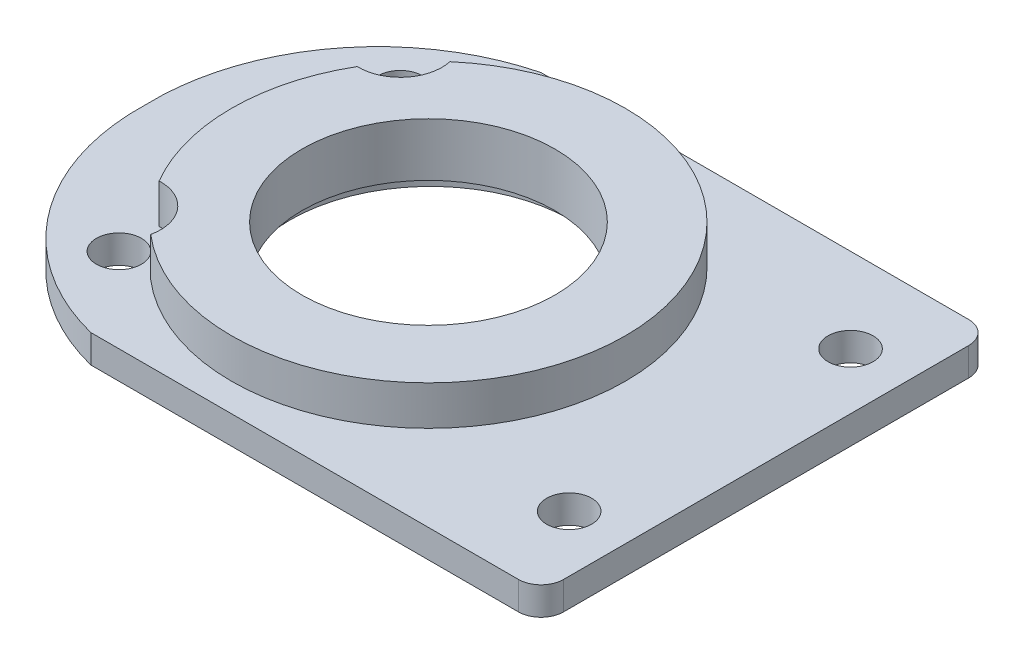
from build123d import *

# Parameters (mm, degrees)
SKETCH1_W               = 76.2
SKETCH1_H               = 50.8
SKETCH1_R               = 14.2748
BOSS_EXTRUDE1_DEPTH     = 3.175
SKETCH2_R               = 22.225
BOSS_EXTRUDE2_DEPTH     = 4.445
SKETCH3_R               = 14.2748
CUT_EXTRUDE1_DEPTH      = 92.688810795
SKETCH4_R               = 15.8623
CUT_EXTRUDE2_DEPTH      = 1.6002
FILLET2_R               = 2.54
CUT_EXTRUDE3_DEPTH      = 92.688810795
CUT_EXTRUDE3_DEPTH_BACK = 92.688810795
SKETCH5_R               = 2.54
CUT_EXTRUDE4_DEPTH      = 92.688810795
SKETCH7_R               = 4.699
CUT_EXTRUDE5_DEPTH      = 92.688810795
SKETCH9_R               = 4.699
CUT_EXTRUDE6_DEPTH      = 92.688810795


with BuildPart() as part:
    # Sketch1 → Boss-Extrude1 (new body)
    with BuildSketch(Plane(origin=(0, 0, 0), x_dir=(1, 0, 0), z_dir=(0, 1, 0))):
        with Locations((38.1, 25.4)):
            Rectangle(SKETCH1_W, SKETCH1_H)
        with Locations(Location((38.1, 25.4, 0), (0, 0, 270))):
            Circle(SKETCH1_R, mode=Mode.SUBTRACT)
    extrude(amount=BOSS_EXTRUDE1_DEPTH)

    # Sketch2 → Boss-Extrude2 (add)
    with BuildSketch(Plane(origin=(0, 3.175, 0), x_dir=(1, 0, 0), z_dir=(0, 1, 0))):
        with Locations(Location((38.1, 25.4, 0), (0, 0, 90))):
            Circle(SKETCH2_R)
    extrude(amount=BOSS_EXTRUDE2_DEPTH)

    # Sketch3 → Cut-Extrude1 (cut, through all)
    with BuildSketch(Plane.XZ.offset(-3.175)):
        with Locations(Location((38.1, -25.4, 0), (0, 0, 270))):
            Circle(SKETCH3_R)
    extrude(amount=-CUT_EXTRUDE1_DEPTH, mode=Mode.SUBTRACT)

    # Sketch4 → Cut-Extrude2 (cut)
    with BuildSketch(Plane(origin=(0, 0, 0), x_dir=(-1, 0, 0), z_dir=(0, -1, 0))):
        with Locations(Location((-38.332507849, 25.4, 0), (0, 0, 90))):
            Circle(SKETCH4_R)
    extrude(amount=-CUT_EXTRUDE2_DEPTH, mode=Mode.SUBTRACT)

    # Fillet2
    fillet2_edges = [part.edges().sort_by_distance(p)[0] for p in [
        (0, 1.5875, -50.8),
        (76.2, 1.5875, -50.8),
        (76.2, 1.5875, 0),
        (0, 1.5875, 0),
    ]]
    fillet(fillet2_edges, radius=FILLET2_R)

    # Sketch5 → Cut-Extrude3 (cut, two sides: drawn at the far end of the back side and taken through both)
    with BuildSketch(Plane(origin=(0, 3.175, 0), x_dir=(1, 0, 0), z_dir=(0, 1, 0)).offset(-CUT_EXTRUDE3_DEPTH_BACK)):
        with Locations(Location((69.85, 41.275, 0), (0, 0, 270))):
            Circle(SKETCH5_R)
        with Locations(Location((69.85, 9.525, 0), (0, 0, 270))):
            Circle(SKETCH5_R)
        with Locations(Location((19.05, 9.525, 0), (0, 0, 270))):
            Circle(SKETCH5_R)
        with Locations(Location((19.05, 41.275, 0), (0, 0, 270))):
            Circle(SKETCH5_R)
    extrude(amount=CUT_EXTRUDE3_DEPTH + CUT_EXTRUDE3_DEPTH_BACK, mode=Mode.SUBTRACT)

    # Sketch6 → Cut-Extrude4 (cut, through all)
    with BuildSketch(Plane(origin=(0, 3.175, 0), x_dir=(1, 0, 0), z_dir=(0, 1, 0))):
        with BuildLine():
            Line((0, 48.26), (0, 2.54))
            ThreePointArc((0, 2.54), (0.743948776, 0.743948776), (2.54, 0))
            Line((2.54, 0), (25.399999995, 0))
            ThreePointArc((25.399999995, 0), (11.359611147, 9.31110396), (6.233986574, 25.359691084))
            ThreePointArc((6.233986574, 25.359691084), (11.333824667, 41.457338196), (25.399999042, 50.8))
            Line((25.399999042, 50.8), (2.54, 50.8))
            ThreePointArc((2.54, 50.8), (0.743948776, 50.056051224), (0, 48.26))
        make_face()
    extrude(amount=-CUT_EXTRUDE4_DEPTH, mode=Mode.SUBTRACT)

    # Sketch7 → Cut-Extrude5 (cut, through all)
    with BuildSketch(Plane(origin=(0, 3.175, 0), x_dir=(1, 0, 0), z_dir=(0, 1, 0))):
        with Locations((19.05, 9.525)):
            Circle(SKETCH7_R)
    extrude(amount=CUT_EXTRUDE5_DEPTH, mode=Mode.SUBTRACT)

    # Sketch9 → Cut-Extrude6 (cut, through all)
    with BuildSketch(Plane(origin=(0, 3.175, 0), x_dir=(1, 0, 0), z_dir=(0, 1, 0))):
        with Locations((19.05, 41.275)):
            Circle(SKETCH9_R)
    extrude(amount=CUT_EXTRUDE6_DEPTH, mode=Mode.SUBTRACT)


solid = part.part
